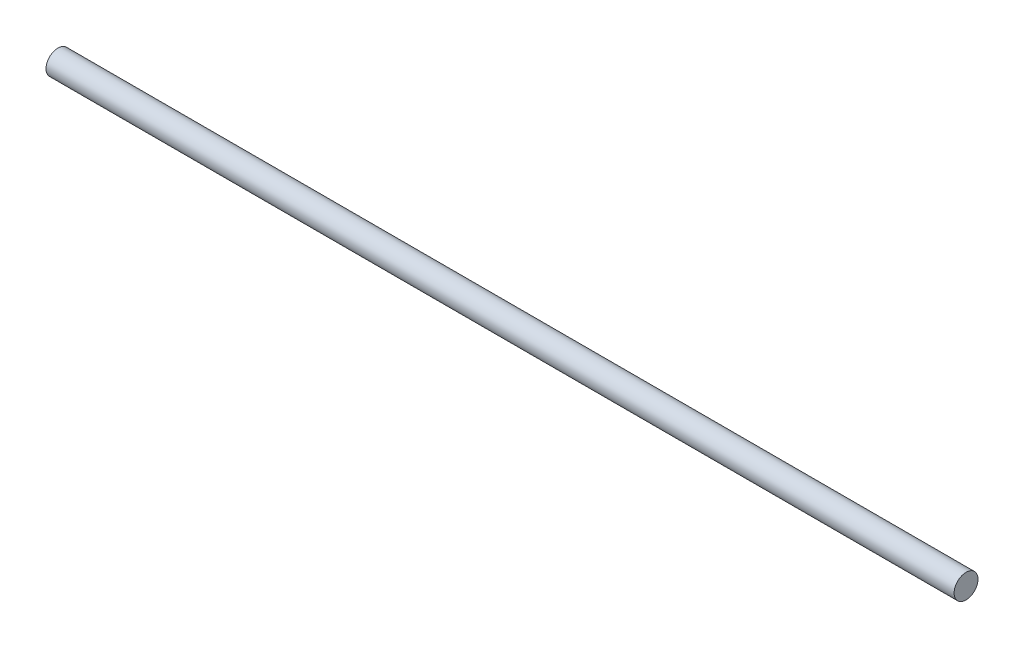
from build123d import *

# Parameters (mm, degrees)
SKETCH1_W = 220
SKETCH1_H = 2.9


with BuildPart() as part:
    # Sketch1 → Revolve1 (revolve)
    with BuildSketch(Plane.XY, mode=Mode.PRIVATE) as revolve1_sk:
        with Locations((20.4400978, 13.687163814)):
            Rectangle(SKETCH1_W, SKETCH1_H)
    revolve(revolve1_sk.sketch.rotate(Axis((-89.5599022, 15.137163814, 0), (1, 0, 0)), 270), axis=Axis((-89.5599022, 15.137163814, 0), (1, 0, 0)))


solid = part.part
